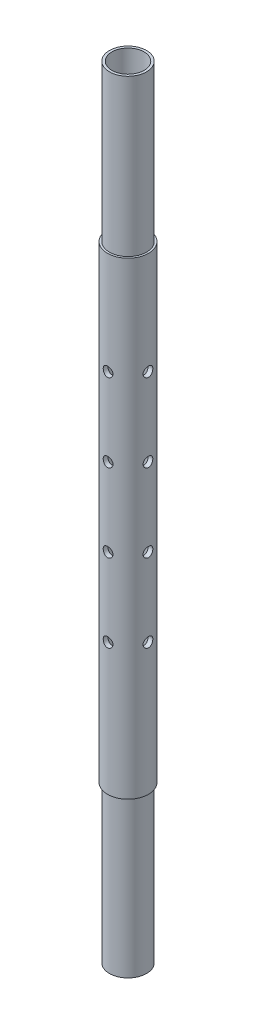
from build123d import *

# Parameters (mm, degrees)
SKETCH1_R           = 13.335
SKETCH1_R_2         = 10.4648
BOSS_EXTRUDE1_DEPTH = 254
SKETCH2_R           = 3.175
CUT_EXTRUDE1_DEPTH  = 63.5
SKETCH3_R           = 3.175
CUT_EXTRUDE2_DEPTH  = 63.5
SKETCH4_R           = 13.335
SKETCH4_R_2         = 12.065
CUT_EXTRUDE3_DEPTH  = 101.6
CUT_EXTRUDE4_START  = -101.6
SKETCH5_R           = 13.335
SKETCH5_R_2         = 12.065
CUT_EXTRUDE4_DEPTH  = 101.6


with BuildPart() as part:
    # Sketch1 → Boss-Extrude1 (new, symmetric)
    with BuildSketch(Plane(origin=(0, 0, 0), x_dir=(1, 0, 0), z_dir=(0, 1, 0))):
        with Locations(Location((0, 0, 0), (0, 0, 270))):
            Circle(SKETCH1_R)
        with Locations(Location((0, 0, 0), (0, 0, 270))):
            Circle(SKETCH1_R_2, mode=Mode.SUBTRACT)
    extrude(amount=BOSS_EXTRUDE1_DEPTH, both=True)

    # Sketch2 → Cut-Extrude1 (cut, symmetric)
    with BuildSketch(Plane.XY):
        with Locations((0, -66.675)):
            Circle(SKETCH2_R)
        with Locations((0, -15.875)):
            Circle(SKETCH2_R)
        with Locations((0, 34.925)):
            Circle(SKETCH2_R)
        with Locations((0, 85.725)):
            Circle(SKETCH2_R)
    extrude(amount=CUT_EXTRUDE1_DEPTH, both=True, mode=Mode.SUBTRACT)

    # Sketch3 → Cut-Extrude2 (cut, symmetric)
    with BuildSketch(Plane(origin=(0, 0, 0), x_dir=(0, 0, -1), z_dir=(1, 0, 0))):
        with Locations((0, -66.675)):
            Circle(SKETCH3_R)
        with Locations((0, -15.875)):
            Circle(SKETCH3_R)
        with Locations((0, 34.925)):
            Circle(SKETCH3_R)
        with Locations((0, 85.725)):
            Circle(SKETCH3_R)
    extrude(amount=CUT_EXTRUDE2_DEPTH, both=True, mode=Mode.SUBTRACT)

    # Sketch4 → Cut-Extrude3 (cut)
    with BuildSketch(Plane(origin=(0, 254, 0), x_dir=(1, 0, 0), z_dir=(0, 1, 0))):
        with Locations(Location((0, 0, 0), (0, 0, 270))):
            Circle(SKETCH4_R)
        with Locations(Location((0, 0, 0), (0, 0, 270))):
            Circle(SKETCH4_R_2, mode=Mode.SUBTRACT)
    extrude(amount=-CUT_EXTRUDE3_DEPTH, mode=Mode.SUBTRACT)

    # Sketch5 → Cut-Extrude4 (cut)
    with BuildSketch(Plane.XZ.offset(254).offset(CUT_EXTRUDE4_START)):
        with Locations(Location((0, 0, 0), (0, 0, 270))):
            Circle(SKETCH5_R)
        with Locations(Location((0, 0, 0), (0, 0, 90))):
            Circle(SKETCH5_R_2, mode=Mode.SUBTRACT)
    extrude(amount=CUT_EXTRUDE4_DEPTH, mode=Mode.SUBTRACT)


solid = part.part
